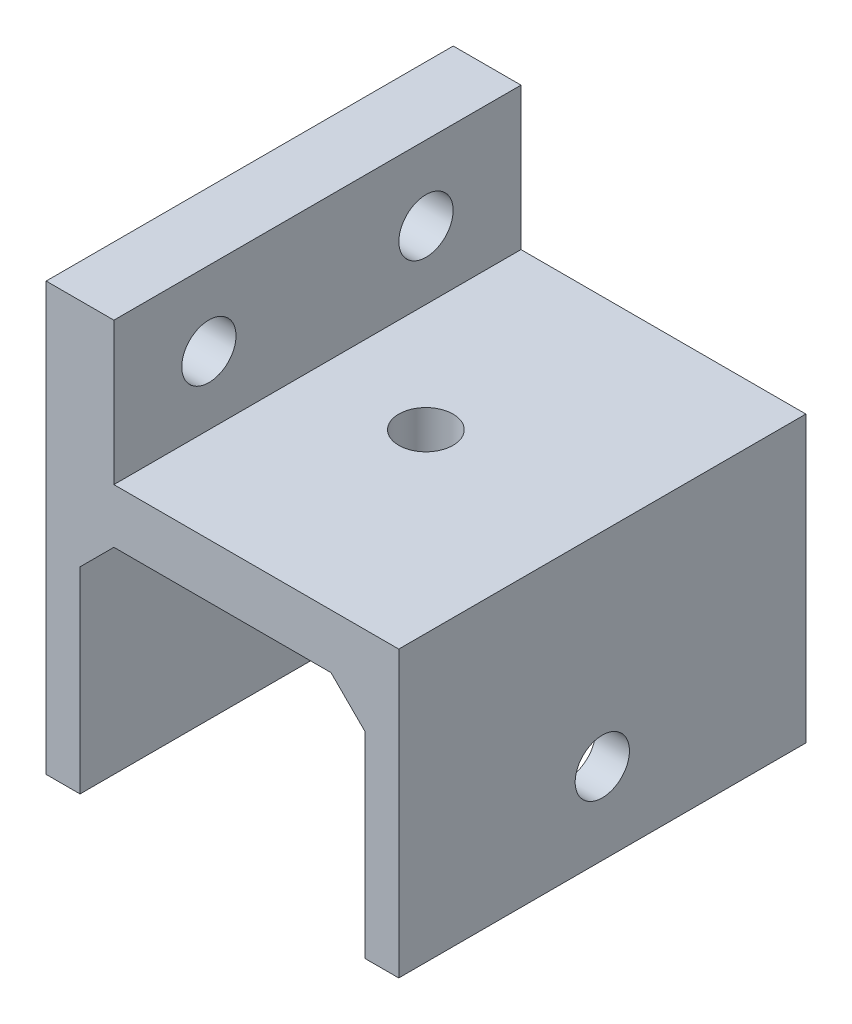
from build123d import *

# Parameters (mm, degrees)
BOSS_EXTRUDE2_DEPTH = 47.625
SKETCH2_R           = 3.175
CUT_EXTRUDE1_DEPTH  = 127.847111609
SKETCH4_R           = 3.175
CUT_EXTRUDE2_DEPTH  = 128.089653795
SKETCH5_R           = 3.175
CUT_EXTRUDE3_DEPTH  = 47.625


with BuildPart() as part:
    # Model → Boss-Extrude2 (new body)
    with BuildSketch(Plane.XY):
        Polygon((112.745318321, 60.38539613), (112.745318321, 93.710196132), (79.420518319, 93.710196132), (79.420518319, 110.37259613), (71.49571832, 110.37259613), (71.49571832, 60.38539613), (75.45811832, 60.38539613), (75.45811832, 83.397796131), (79.420518319, 87.360196131), (104.82051832, 87.360196131), (108.782918319, 83.397796131), (108.782918319, 60.38539613), align=None)
    extrude(amount=BOSS_EXTRUDE2_DEPTH)

    # Sketch2 → Cut-Extrude1 (cut, through all)
    with BuildSketch(Plane(origin=(0, 93.710196132, 0), x_dir=(1, 0, 0), z_dir=(0, 1, 0))):
        with Locations(Location((92.107818321, -23.8125, 0), (0, 0, 270))):
            Circle(SKETCH2_R)
    extrude(amount=-CUT_EXTRUDE1_DEPTH, mode=Mode.SUBTRACT)

    # Sketch4 → Cut-Extrude2 (cut, through all)
    with BuildSketch(Plane.ZY.offset(-71.49571832)):
        with Locations((11.1125, 101.66039613)):
            Circle(SKETCH4_R)
        with Locations((36.5125, 101.66039613)):
            Circle(SKETCH4_R)
    extrude(amount=-CUT_EXTRUDE2_DEPTH, mode=Mode.SUBTRACT)

    # Sketch5 → Cut-Extrude3 (cut)
    with BuildSketch(Plane(origin=(112.745318321, 0, 0), x_dir=(0, 0, -1), z_dir=(1, 0, 0))):
        with Locations((-23.8125, 69.91039613)):
            Circle(SKETCH5_R)
    extrude(amount=-CUT_EXTRUDE3_DEPTH, mode=Mode.SUBTRACT)


solid = part.part
